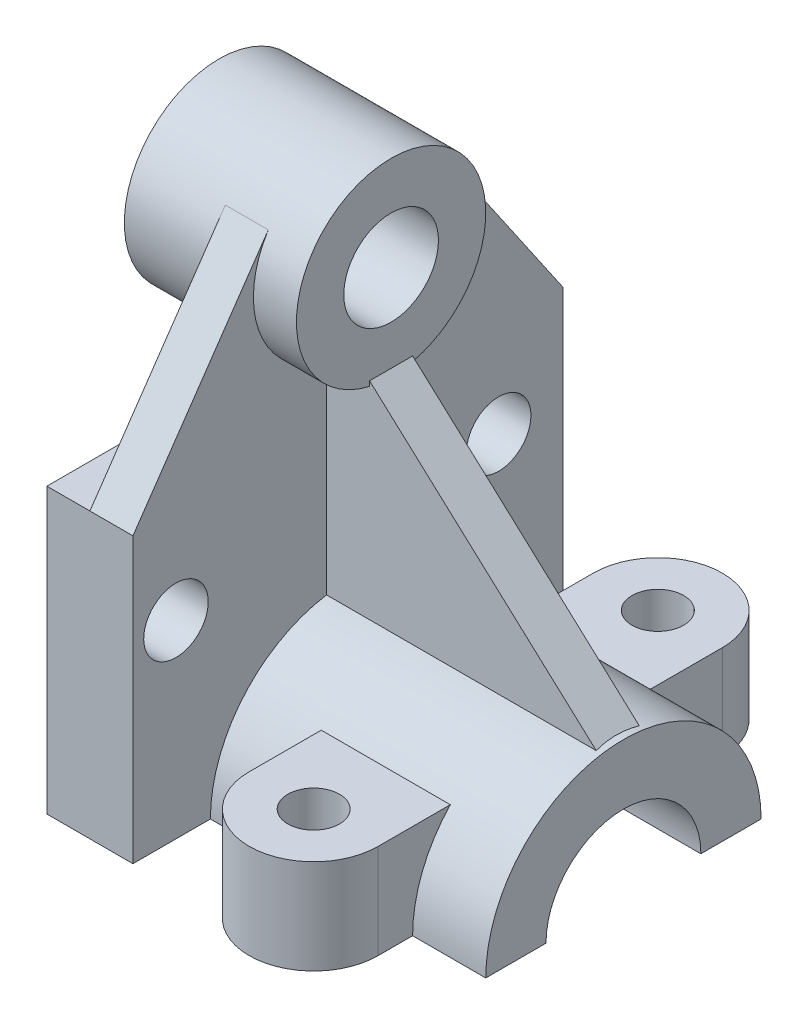
from build123d import *

# Parameters (mm, degrees)
SKETCH2_W            = 20
SKETCH2_H            = 66
BOSS_EXTRUDE1_DEPTH  = 100
SKETCH3_R            = 11
BOSS_EXTRUDE2_DEPTH  = 10
BOSS_EXTRUDE3_START  = 10
SKETCH4_R            = 22
SKETCH4_R_2          = 11
BOSS_EXTRUDE3_DEPTH  = 10
SKETCH5_R            = 22
SKETCH5_R_2          = 11
BOSS_EXTRUDE4_DEPTH  = 40
BOSS_EXTRUDE5_DEPTH  = 64
BOSS_EXTRUDE10_DEPTH = 5
SKETCH16_R           = 6
BOSS_EXTRUDE11_DEPTH = 22
SKETCH18_R           = 7.5
CUT_EXTRUDE2_DEPTH   = 22


with BuildPart() as part:
    # Sketch2 → Boss-Extrude1 (new body)
    with BuildSketch(Plane.XY):
        with Locations((-12.101382488, 33)):
            Rectangle(SKETCH2_W, SKETCH2_H)
    extrude(amount=-BOSS_EXTRUDE1_DEPTH)

    # Sketch3 → Boss-Extrude2 (add)
    # profile 1 of 2: a face of its own
    with BuildSketch(Plane(origin=(-2.101382488, 0, 0), x_dir=(0, 0, -1), z_dir=(1, 0, 0))):
        with BuildLine():
            Line((31.462791547, 111.847864903), (0, 66))
            Line((0, 66), (100, 66))
            Line((100, 66), (68.537208453, 111.847864903))
            ThreePointArc((68.537208453, 111.847864903), (71.116564422, 106.171766928), (72, 100))
            ThreePointArc((72, 100), (43.828233072, 78.883435578), (31.462791547, 111.847864903))
        make_face()
    # profile 2 of 2: a face of its own
    with BuildSketch(Plane(origin=(-2.101382488, 0, 0), x_dir=(0, 0, -1), z_dir=(1, 0, 0))):
        with BuildLine():
            Line((32.277524622, 113.035101322), (31.462791547, 111.847864903))
            ThreePointArc((31.462791547, 111.847864903), (43.828233072, 78.883435578), (72, 100))
            ThreePointArc((72, 100), (71.116564422, 106.171766928), (68.537208453, 111.847864903))
            Line((68.537208453, 111.847864903), (67.722475378, 113.035101322))
            ThreePointArc((67.722475378, 113.035101322), (50, 122), (32.277524622, 113.035101322))
        make_face()
        with Locations(Location((50, 100, 0), (0, 0, 90))):
            Circle(SKETCH3_R, mode=Mode.SUBTRACT)
    extrude(amount=-BOSS_EXTRUDE2_DEPTH)

    # Sketch4 → Boss-Extrude3 (add)
    with BuildSketch(Plane(origin=(-2.101382488, 0, 0), x_dir=(0, 0, -1), z_dir=(1, 0, 0)).offset(BOSS_EXTRUDE3_START)):
        with Locations(Location((50, 100, 0), (0, 0, 90))):
            Circle(SKETCH4_R)
        with Locations(Location((50, 100, 0), (0, 0, 90))):
            Circle(SKETCH4_R_2, mode=Mode.SUBTRACT)
    extrude(amount=-BOSS_EXTRUDE3_DEPTH)

    # Sketch5 → Boss-Extrude4 (add)
    with BuildSketch(Plane(origin=(7.898617512, 0, 0), x_dir=(0, 0, -1), z_dir=(1, 0, 0))):
        with Locations(Location((50, 100, 0), (0, 0, 90))):
            Circle(SKETCH5_R)
        with Locations(Location((50, 100, 0), (0, 0, 90))):
            Circle(SKETCH5_R_2, mode=Mode.SUBTRACT)
    extrude(amount=-BOSS_EXTRUDE4_DEPTH)

    # Sketch6 → Boss-Extrude5 (add)
    with BuildSketch(Plane(origin=(-2.101382488, 0, 0), x_dir=(0, 0, -1), z_dir=(1, 0, 0))):
        with BuildLine():
            ThreePointArc((32, 0), (50, 18), (68, 0))
            Line((68, 0), (82, 0))
            ThreePointArc((82, 0), (50, 32), (18, 0))
            Line((18, 0), (32, 0))
        make_face()
    extrude(amount=BOSS_EXTRUDE5_DEPTH)

    # Sketch9 → Boss-Extrude10 (add, symmetric)
    with BuildSketch(Plane(origin=(0, 0, -50), x_dir=(-1, 0, 0), z_dir=(0, 0, -1))):
        Polygon((-61.898617512, 30.402989501), (4.356494358, 30.402989501), (4.356494358, 79.707135775), (-7.898617512, 79.707135775), align=None)
    extrude(amount=BOSS_EXTRUDE10_DEPTH, both=True)

    # Sketch16 → Boss-Extrude11 (add)
    # profile 1 of 2: a face of its own
    with BuildSketch(Plane.XZ):
        with BuildLine():
            Line((14.898617512, -32), (14.898617512, -10))
            ThreePointArc((14.898617512, -10), (29.898617512, 5), (44.898617512, -10))
            Line((44.898617512, -10), (44.898617512, -32))
            Line((44.898617512, -32), (14.898617512, -32))
        make_face()
        with Locations((29.898617512, -10)):
            Circle(SKETCH16_R, mode=Mode.SUBTRACT)
    # profile 2 of 2: a face of its own
    with BuildSketch(Plane.XZ):
        with BuildLine():
            Line((14.898617512, -68), (14.898617512, -90))
            ThreePointArc((14.898617512, -90), (29.898617512, -105), (44.898617512, -90))
            Line((44.898617512, -90), (44.898617512, -68))
            Line((44.898617512, -68), (14.898617512, -68))
        make_face()
        with Locations((29.898617512, -90)):
            Circle(SKETCH16_R, mode=Mode.SUBTRACT)
    extrude(amount=-BOSS_EXTRUDE11_DEPTH)

    # Sketch18 → Cut-Extrude2 (cut)
    with BuildSketch(Plane(origin=(-2.101382488, 0, 0), x_dir=(0, 0, -1), z_dir=(1, 0, 0))):
        with Locations(Location((10, 44, 0), (0, 0, 90))):
            Circle(SKETCH18_R)
        with Locations(Location((85, 44, 0), (0, 0, 90))):
            Circle(SKETCH18_R)
    extrude(amount=-CUT_EXTRUDE2_DEPTH, mode=Mode.SUBTRACT)


solid = part.part
